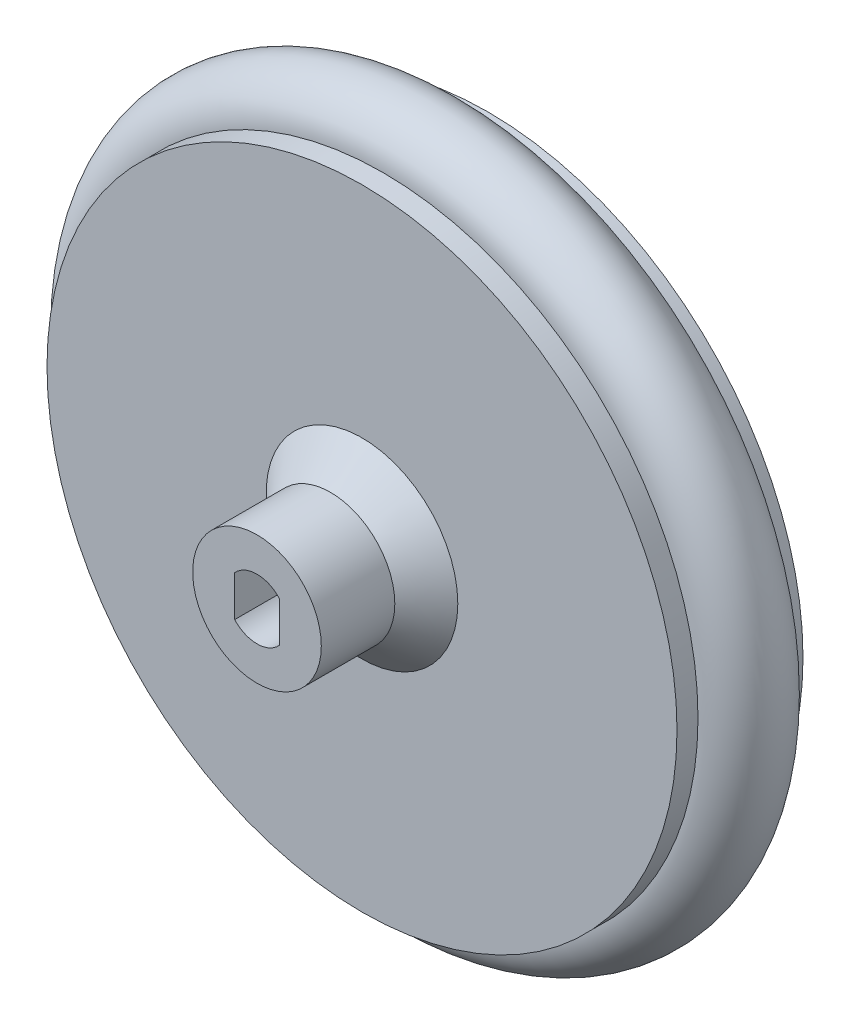
from build123d import *

# Parameters (mm, degrees)
CROQUIS1_R              = 30
SALIENTE_EXTRUIR1_DEPTH = 12
CROQUIS2_R              = 4
CROQUIS3_R              = 6.125
SALIENTE_EXTRUIR2_DEPTH = 10
CROQUIS4_R              = 1.25
CORTAR_EXTRUIR1_DEPTH   = 45.09081537
CHAFL_N1_SIZE           = 3
CROQUIS5_R              = 4


with BuildPart() as part:
    # Croquis1 → Saliente-Extruir1 (new body)
    with BuildSketch(Plane.XY):
        Circle(CROQUIS1_R)
    extrude(amount=SALIENTE_EXTRUIR1_DEPTH)

    # Croquis2 → Cortar-Revolución1 (revolve, cut)
    with BuildSketch(Plane(origin=(0, 0, 0), x_dir=(1, 0, 0), z_dir=(0, 1, 0))):
        with Locations((-30, -6)):
            Circle(CROQUIS2_R)
    revolve(axis=Axis((0, 0, 0), (0, 0, 1)), mode=Mode.SUBTRACT)

    # Croquis3 → Saliente-Extruir2 (add)
    with BuildSketch(Plane.XY.offset(12)):
        Circle(CROQUIS3_R)
        with BuildLine():
            Line((-2.125, 1.936491673), (-2.125, -1.936491673))
            ThreePointArc((-2.125, -1.936491673), (0, -2.875), (2.125, -1.936491673))
            Line((2.125, -1.936491673), (2.125, 1.936491673))
            ThreePointArc((2.125, 1.936491673), (0, 2.875), (-2.125, 1.936491673))
        make_face(mode=Mode.SUBTRACT)
    extrude(amount=SALIENTE_EXTRUIR2_DEPTH)

    # Croquis4 → Cortar-Extruir1 (cut, through all)
    with BuildSketch(Plane.XY.offset(12)):
        Circle(CROQUIS4_R)
    extrude(amount=-CORTAR_EXTRUIR1_DEPTH, mode=Mode.SUBTRACT)

    # Chaflán1
    chafl_n1_edges = [part.edges().sort_by_distance(p)[0] for p in [
        (-6.125, 0, 12),
    ]]
    chamfer(chafl_n1_edges, length=CHAFL_N1_SIZE)

    # Croquis5 → Revolución1 (revolve)
    with BuildSketch(Plane(origin=(0, 0, 0), x_dir=(0, 0, -1), z_dir=(1, 0, 0)), mode=Mode.PRIVATE) as revoluci_n1_sk:
        with Locations((-6, 30)):
            Circle(CROQUIS5_R)
    revolve(revoluci_n1_sk.sketch.rotate(Axis((0, 0, 0), (0, 0, -1)), 270), axis=Axis((0, 0, 0), (0, 0, -1)))


solid = part.part
